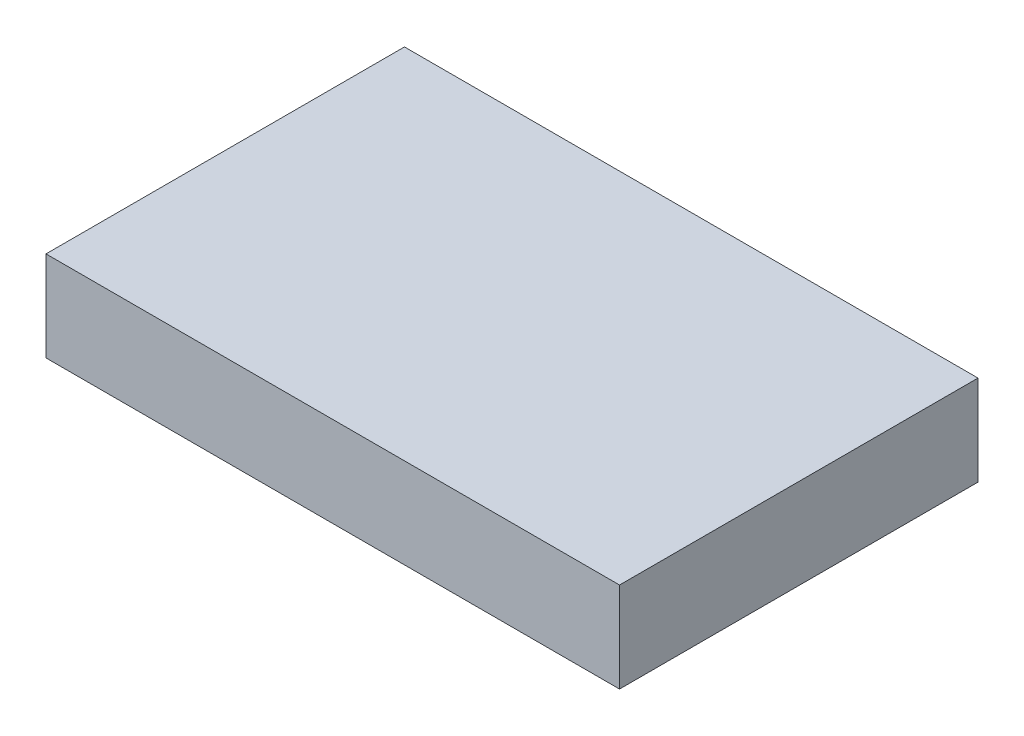
from build123d import *

# Parameters (mm, degrees)
SKIZZE1_W                       = 280
SKIZZE1_H                       = 175
AUFSATZ_LINEAR_AUSTRAGEN1_DEPTH = 44


with BuildPart() as part:
    # Skizze1 → Aufsatz-Linear austragen1 (new body)
    with BuildSketch(Plane(origin=(0, 0, 0), x_dir=(1, 0, 0), z_dir=(0, 1, 0))):
        Rectangle(SKIZZE1_W, SKIZZE1_H)
    extrude(amount=AUFSATZ_LINEAR_AUSTRAGEN1_DEPTH)


solid = part.part
